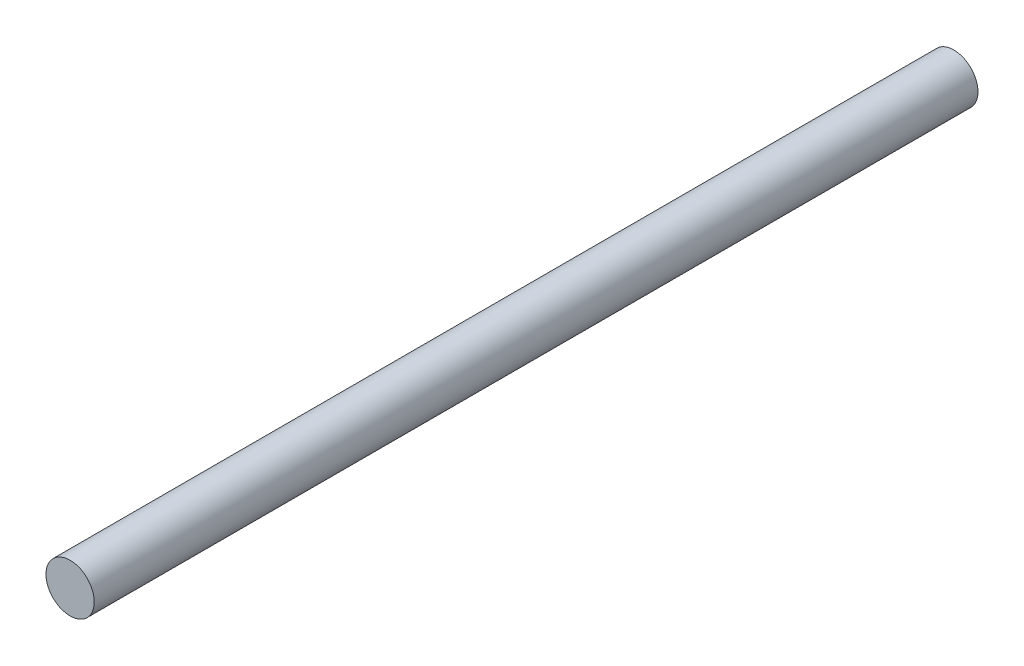
from build123d import *

# Parameters (mm, degrees)
ESQUISSE1_R        = 2.95
BOSS_EXTRU_1_DEPTH = 108


with BuildPart() as part:
    # Esquisse1 → Boss.-Extru.1 (new body)
    with BuildSketch(Plane.XY):
        Circle(ESQUISSE1_R)
    extrude(amount=BOSS_EXTRU_1_DEPTH)


solid = part.part
